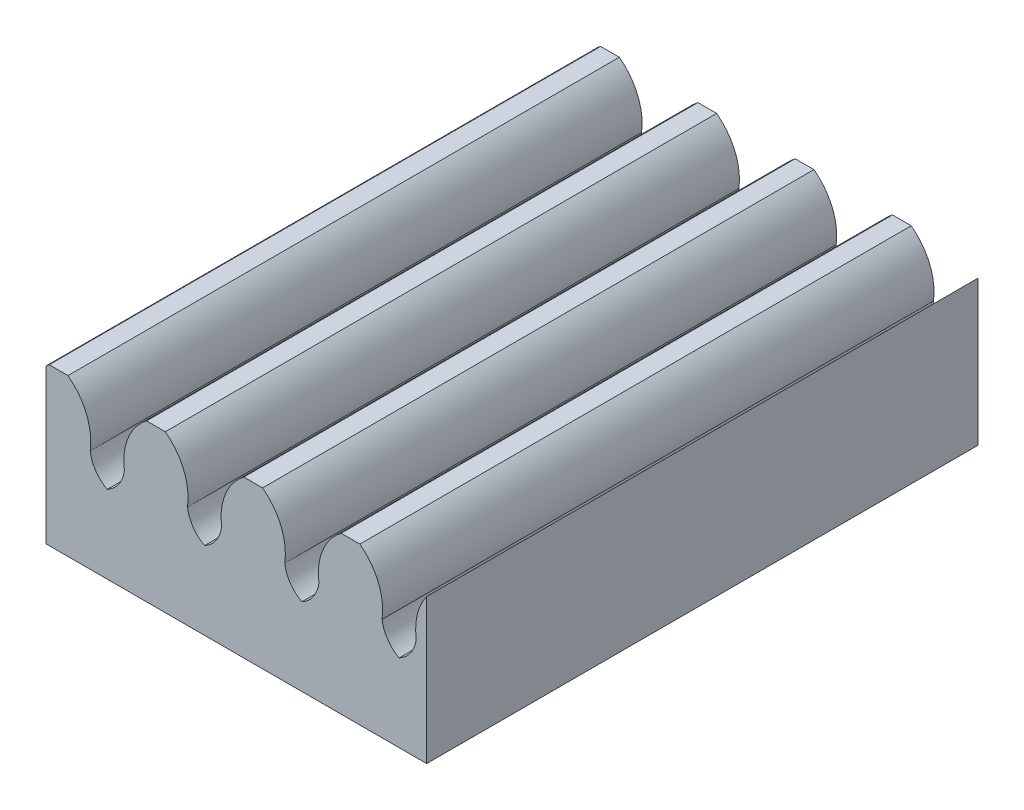
from build123d import *

# Parameters (mm, degrees)
BOSS_EXTRUDE1_DEPTH  = 25.5
CUT_EXTRUDE1_DEPTH   = 26.12
LPATTERN1_COUNT      = 4
LPATTERN1_PITCH      = 4.5
LPATTERN1_COUNT_DIR2 = 9
LPATTERN1_PITCH_DIR2 = 4.5


with BuildPart() as part:
    # Sketch1 → Boss-Extrude1 (new body)
    with BuildSketch(Plane.XY):
        Polygon((-14.215030011, 7), (-14.215030011, -0.249149017), (0.939234275, -0.249149017), (3.390192413, -0.249149017), (3.390192413, 7), align=None)
    extrude(amount=BOSS_EXTRUDE1_DEPTH)

    # Sketch2 → Cut-Extrude1 (cut)
    with BuildSketch(Plane.XY):
        with BuildLine():
            ThreePointArc((-6.881285782, 3.348371163), (-7.417069895, 3.826658598), (-7.671285782, 4.498371163))
            ThreePointArc((-7.671285782, 4.498371163), (-7.912320341, 6.04482582), (-8.981285782, 7.188037328))
            ThreePointArc((-8.981285782, 7.188037328), (-6.881285782, 7.762283268), (-4.781285782, 7.188037328))
            ThreePointArc((-4.781285782, 7.188037328), (-5.850251222, 6.04482582), (-6.091285782, 4.498371163))
            ThreePointArc((-6.091285782, 4.498371163), (-6.345501668, 3.826658598), (-6.881285782, 3.348371163))
        make_face()
    cut_extrude1 = extrude(amount=CUT_EXTRUDE1_DEPTH, mode=Mode.SUBTRACT)

    # LPattern1: Cut-Extrude1 4 × 9
    with Locations(*[Vector(-1, 0, 0) * (i * LPATTERN1_PITCH) + Vector(1, 0, 0) * (j * LPATTERN1_PITCH_DIR2) for i in range(LPATTERN1_COUNT) for j in range(LPATTERN1_COUNT_DIR2) if (i, j) != (0, 0)]):
        add(cut_extrude1, mode=Mode.SUBTRACT)


solid = part.part
